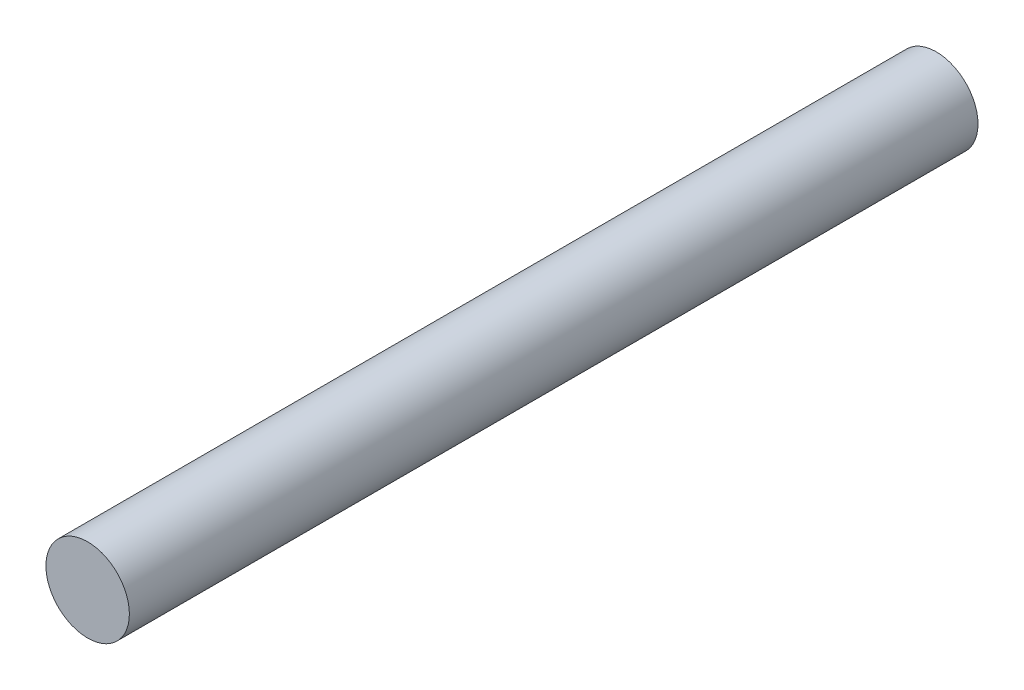
from build123d import *

# Parameters (mm, degrees)
SKETCH_1_R      = 29.5
EXTRUDE_1_DEPTH = 600


with BuildPart() as part:
    # 草图1 → 凸台-拉伸1 (new body)
    with BuildSketch(Plane.XY):
        with Locations((-0.364847958, -188.000481983)):
            Circle(SKETCH_1_R)
    extrude(amount=EXTRUDE_1_DEPTH)


solid = part.part
